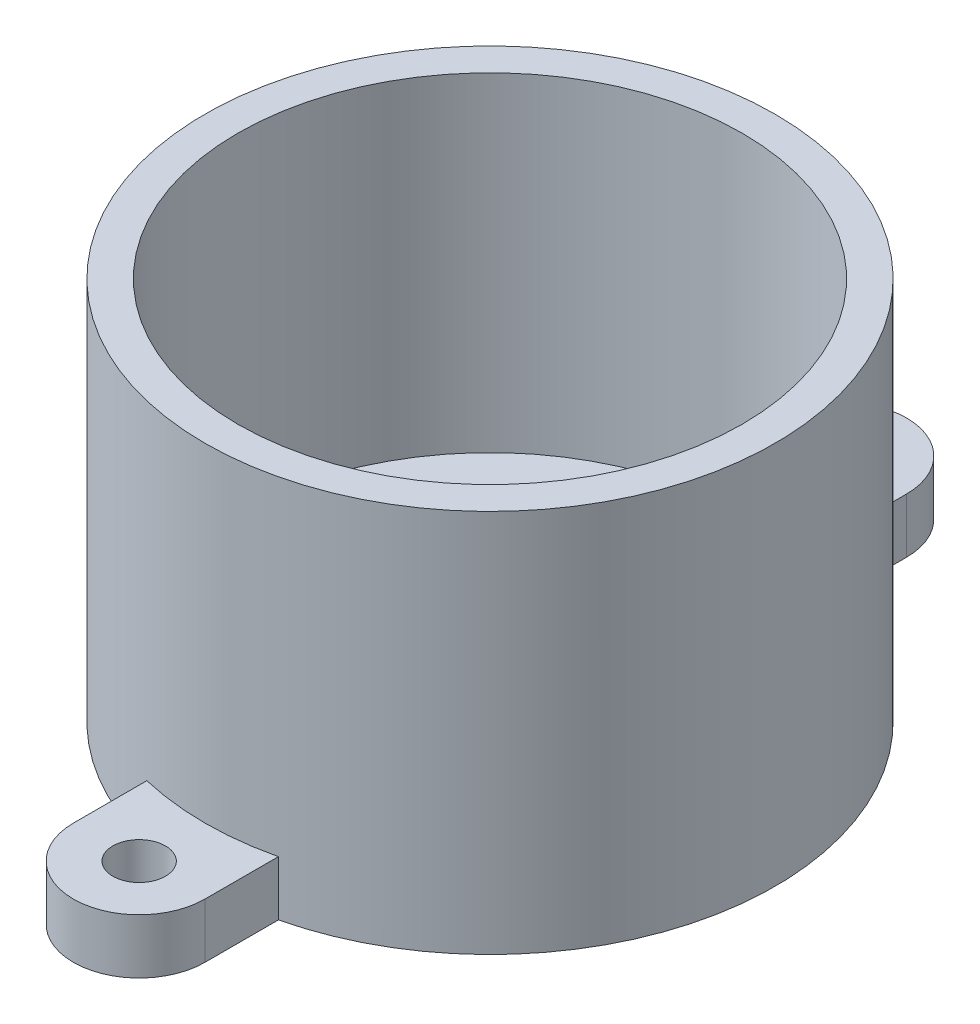
from build123d import *

# Parameters (mm, degrees)
SKETCH1_R               = 13
BOSS_EXTRUDE1_DEPTH     = 2.5
BOSS_EXTRUDE2_START     = 2.5
SKETCH2_R               = 13
SKETCH2_R_2             = 11.5
BOSS_EXTRUDE2_DEPTH     = 15
CUT_EXTRUDE1_START      = 2.5
SKETCH3_R               = 5.5
CUT_EXTRUDE1_DEPTH      = 1.2
CUT_EXTRUDE2_DEPTH      = 26.382080293
CUT_EXTRUDE2_DEPTH_BACK = 26.382080293
SKETCH4_R               = 1.2
SKETCH4_R_2             = 2
SKETCH5_R               = 1.2
BOSS_EXTRUDE3_DEPTH     = 2.5


with BuildPart() as part:
    # Sketch1 → Boss-Extrude1 (new body)
    with BuildSketch(Plane(origin=(0, 0, 0), x_dir=(1, 0, 0), z_dir=(0, 1, 0))):
        with Locations(Location((0, 0, 0), (0, 0, 270))):
            Circle(SKETCH1_R)
    extrude(amount=BOSS_EXTRUDE1_DEPTH)

    # Sketch2 → Boss-Extrude2 (add)
    with BuildSketch(Plane(origin=(0, 0, 0), x_dir=(1, 0, 0), z_dir=(0, 1, 0)).offset(BOSS_EXTRUDE2_START)):
        with Locations(Location((0, 0, 0), (0, 0, 270))):
            Circle(SKETCH2_R)
        with Locations(Location((0, 0, 0), (0, 0, 270))):
            Circle(SKETCH2_R_2, mode=Mode.SUBTRACT)
    extrude(amount=BOSS_EXTRUDE2_DEPTH)

    # Sketch3 → Cut-Extrude1 (cut)
    with BuildSketch(Plane(origin=(0, 0, 0), x_dir=(1, 0, 0), z_dir=(0, 1, 0)).offset(CUT_EXTRUDE1_START)):
        with Locations(Location((0, 0, 0), (0, 0, 270))):
            Circle(SKETCH3_R)
    extrude(amount=-CUT_EXTRUDE1_DEPTH, mode=Mode.SUBTRACT)

    # Sketch4 → Cut-Extrude2 (cut, two sides: drawn at the far end of the back side and taken through both)
    with BuildSketch(Plane(origin=(0, 0, 0), x_dir=(1, 0, 0), z_dir=(0, 1, 0)).offset(-CUT_EXTRUDE2_DEPTH_BACK)):
        with Locations(Location((0, 8.5, 0), (0, 0, 270))):
            Circle(SKETCH4_R)
        with Locations(Location((7.361215932, -4.25, 0), (0, 0, 270))):
            Circle(SKETCH4_R)
        with Locations(Location((-7.361215932, -4.25, 0), (0, 0, 270))):
            Circle(SKETCH4_R)
        with Locations(Location((0, 0, 0), (0, 0, 270))):
            Circle(SKETCH4_R_2)
    extrude(amount=CUT_EXTRUDE2_DEPTH + CUT_EXTRUDE2_DEPTH_BACK, mode=Mode.SUBTRACT)

    # Sketch5 → Boss-Extrude3 (add)
    # profile 1 of 2: a face of its own
    with BuildSketch(Plane(origin=(0, 0, 0), x_dir=(1, 0, 0), z_dir=(0, 1, 0))):
        with BuildLine():
            Line((-3, 12.649110641), (-3, 16))
            ThreePointArc((-3, 16), (-2.121320344, 18.121320344), (0, 19))
            ThreePointArc((0, 19), (2.121320344, 18.121320344), (3, 16))
            Line((3, 16), (3, 12.649110641))
            ThreePointArc((3, 12.649110641), (0, 13), (-3, 12.649110641))
        make_face()
        with Locations(Location((0, 16, 0), (0, 0, 270))):
            Circle(SKETCH5_R, mode=Mode.SUBTRACT)
    # profile 2 of 2: a face of its own
    with BuildSketch(Plane(origin=(0, 0, 0), x_dir=(1, 0, 0), z_dir=(0, 1, 0))):
        with BuildLine():
            Line((3, -16), (3, -12.649110641))
            ThreePointArc((3, -12.649110641), (0, -13), (-3, -12.649110641))
            Line((-3, -12.649110641), (-3, -16))
            ThreePointArc((-3, -16), (-2.121320344, -18.121320344), (0, -19))
            ThreePointArc((0, -19), (2.121320344, -18.121320344), (3, -16))
        make_face()
        with Locations(Location((0, -16, 0), (0, 0, 90))):
            Circle(SKETCH5_R, mode=Mode.SUBTRACT)
    extrude(amount=BOSS_EXTRUDE3_DEPTH)


solid = part.part
